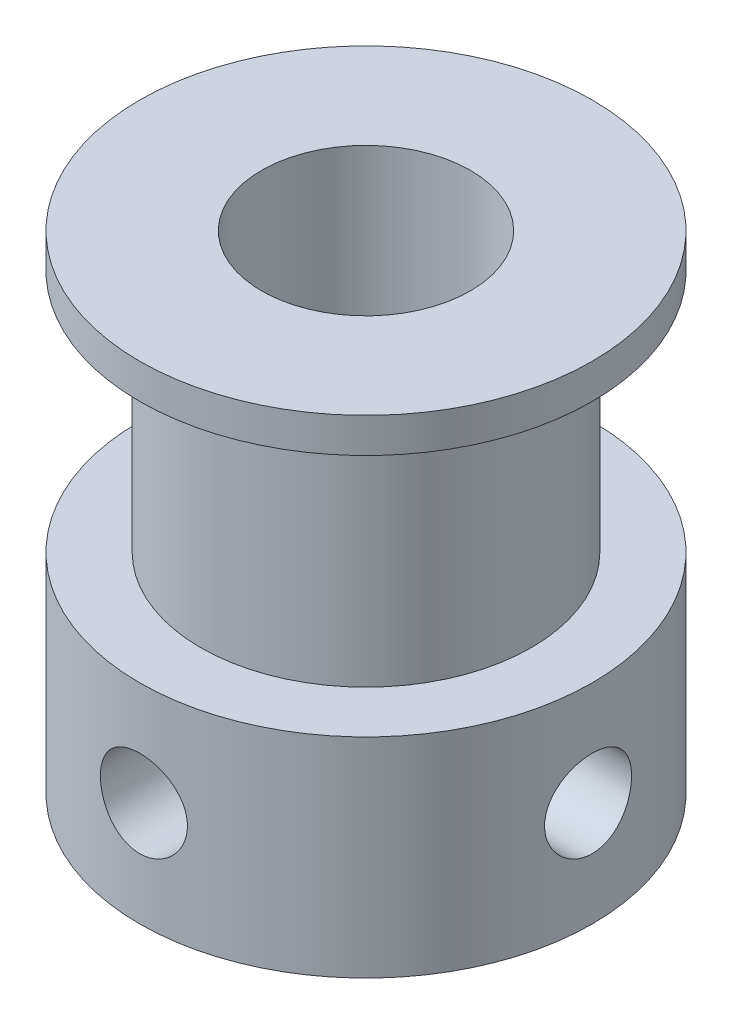
from build123d import *


with BuildPart() as part:
    # 草图1 → 旋转1 (revolve)
    with BuildSketch(Plane.XY, mode=Mode.PRIVATE) as revolve_1_sk:
        Polygon((3, 0), (6.5, 0), (6.5, 6), (4.75, 6), (4.75, 13), (6.5, 13), (6.5, 14), (3, 14), align=None)
    revolve(revolve_1_sk.sketch.rotate(Axis((0, 0, 0), (0, 1, 0)), 90), axis=Axis((0, 0, 0), (0, 1, 0)))

    # 草图3 → M3 螺纹孔1 (revolve, cut)
    with BuildSketch(Plane(origin=(0, 3, 0), x_dir=(0, 1, 0), z_dir=(1, 0, 0))):
        Polygon((0, 0), (0, 6.5), (1.25, 6.5), (1.25, 0.275), (1.525, 0), align=None)
    revolve(axis=Axis((0, 3, -6.35), (0, 0, 1)), mode=Mode.SUBTRACT)

    # 草图5 → M3 螺纹孔2 (revolve, cut)
    with BuildSketch(Plane.ZX.offset(3)):
        Polygon((0, 0), (0, 6.5), (1.25, 6.5), (1.25, 0.275), (1.525, 0), align=None)
    revolve(axis=Axis((-6.35, 3, 0), (1, 0, 0)), mode=Mode.SUBTRACT)


solid = part.part
